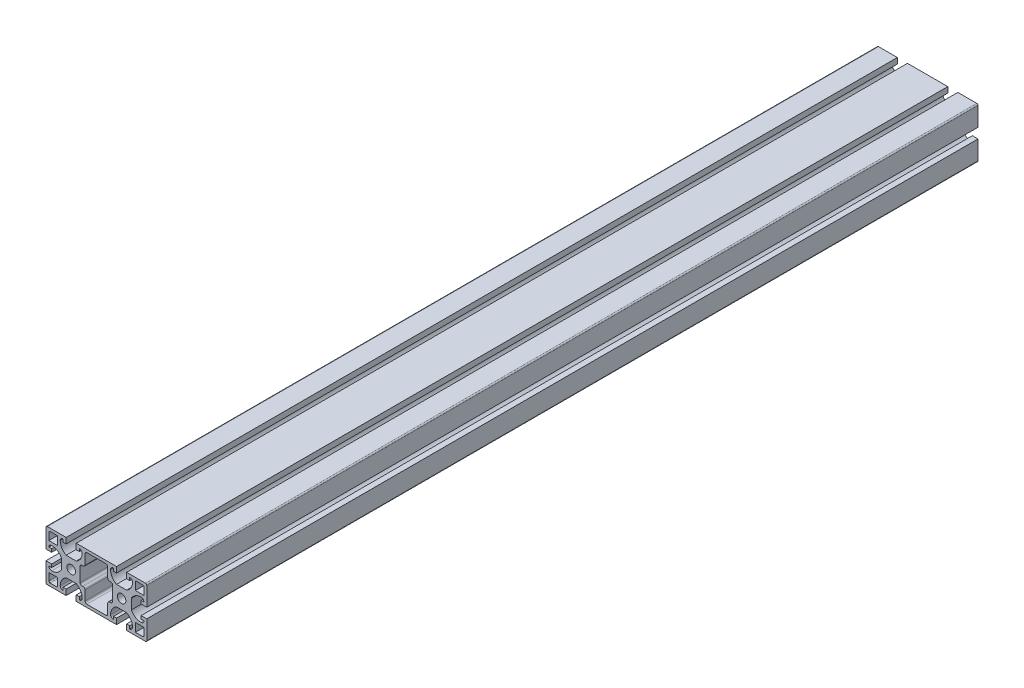
from build123d import *

# Parameters (mm, degrees)
SZKIC1_R                    = 3.4
DODANIE_WYCI_GNI_CIE1_DEPTH = 660
SZKIC2_W                    = 2.25
SZKIC2_H                    = 8
WYTNIJ_WYCI_GNI_CIE1_DEPTH  = 662.513416342


with BuildPart() as part:
    # Szkic1 → Dodanie-wyciągnięcie1 (new body)
    with BuildSketch(Plane.XY):
        with BuildLine():
            Line((-40, -19), (-40, 19))
            ThreePointArc((-40, 19), (-39.707106781, 19.707106781), (-39, 20))
            Line((-39, 20), (-24, 20))
            Line((-24, 20), (-24, 15.5))
            Line((-24, 15.5), (-26.471381771, 15.5))
            Line((-26.471381771, 15.5), (-26.471381771, 17.75))
            ThreePointArc((-26.471381771, 17.75), (-28.062372029, 17.090990258), (-28.721381771, 15.5))
            ThreePointArc((-28.721381771, 15.5), (-27.448087912, 10.962546258), (-24, 7.75))
            Line((-24, 7.75), (-16, 7.75))
            ThreePointArc((-16, 7.75), (-12.551912088, 10.962546258), (-11.278618229, 15.5))
            ThreePointArc((-11.278618229, 15.5), (-11.937627971, 17.090990258), (-13.528618229, 17.75))
            Line((-13.528618229, 17.75), (-13.528618229, 15.5))
            Line((-13.528618229, 15.5), (-16, 15.5))
            Line((-16, 15.5), (-16, 20))
            Line((-16, 20), (13.528618229, 20))
            Line((13.528618229, 20), (16, 20))
            Line((16, 20), (16, 15.5))
            Line((16, 15.5), (13.528618229, 15.5))
            Line((13.528618229, 15.5), (13.528618229, 17.75))
            ThreePointArc((13.528618229, 17.75), (11.937627971, 17.090990258), (11.278618229, 15.5))
            ThreePointArc((11.278618229, 15.5), (12.551912088, 10.962546258), (16, 7.75))
            Line((16, 7.75), (24, 7.75))
            ThreePointArc((24, 7.75), (27.448087912, 10.962546258), (28.721381771, 15.5))
            ThreePointArc((28.721381771, 15.5), (28.062372029, 17.090990258), (26.471381771, 17.75))
            Line((26.471381771, 17.75), (26.471381771, 15.5))
            Line((26.471381771, 15.5), (24, 15.5))
            Line((24, 15.5), (24, 20))
            Line((24, 20), (39, 20))
            ThreePointArc((39, 20), (39.707106781, 19.707106781), (40, 19))
            Line((40, 19), (40, 4))
            Line((40, 4), (35.5, 4))
            Line((35.5, 4), (35.5, 6.471381771))
            Line((35.5, 6.471381771), (37.75, 6.471381771))
            ThreePointArc((37.75, 6.471381771), (37.090990258, 8.062372029), (35.5, 8.721381771))
            ThreePointArc((35.5, 8.721381771), (30.962546258, 7.448087912), (27.75, 4))
            Line((27.75, 4), (27.75, -4))
            ThreePointArc((27.75, -4), (30.962546258, -7.448087912), (35.5, -8.721381771))
            ThreePointArc((35.5, -8.721381771), (37.090990258, -8.062372029), (37.75, -6.471381771))
            Line((37.75, -6.471381771), (35.5, -6.471381771))
            Line((35.5, -6.471381771), (35.5, -4))
            Line((35.5, -4), (40, -4))
            Line((40, -4), (40, -19))
            ThreePointArc((40, -19), (39.707106781, -19.707106781), (39, -20))
            Line((39, -20), (24, -20))
            Line((24, -20), (24, -15.5))
            Line((24, -15.5), (26.471381771, -15.5))
            Line((26.471381771, -15.5), (26.471381771, -17.75))
            ThreePointArc((26.471381771, -17.75), (28.062372029, -17.090990258), (28.721381771, -15.5))
            ThreePointArc((28.721381771, -15.5), (27.448087912, -10.962546258), (24, -7.75))
            Line((24, -7.75), (16, -7.75))
            ThreePointArc((16, -7.75), (12.551912088, -10.962546258), (11.278618229, -15.5))
            ThreePointArc((11.278618229, -15.5), (11.937627971, -17.090990258), (13.528618229, -17.75))
            Line((13.528618229, -17.75), (13.528618229, -15.5))
            Line((13.528618229, -15.5), (16, -15.5))
            Line((16, -15.5), (16, -20))
            Line((16, -20), (-16, -20))
            Line((-16, -20), (-16, -15.5))
            Line((-16, -15.5), (-13.528618229, -15.5))
            Line((-13.528618229, -15.5), (-13.528618229, -17.75))
            ThreePointArc((-13.528618229, -17.75), (-11.937627971, -17.090990258), (-11.278618229, -15.5))
            ThreePointArc((-11.278618229, -15.5), (-12.551912088, -10.962546258), (-16, -7.75))
            Line((-16, -7.75), (-24, -7.75))
            ThreePointArc((-24, -7.75), (-27.448087912, -10.962546258), (-28.721381771, -15.5))
            ThreePointArc((-28.721381771, -15.5), (-28.062372029, -17.090990258), (-26.471381771, -17.75))
            Line((-26.471381771, -17.75), (-26.471381771, -15.5))
            Line((-26.471381771, -15.5), (-24, -15.5))
            Line((-24, -15.5), (-24, -20))
            Line((-24, -20), (-39, -20))
            ThreePointArc((-39, -20), (-39.707106781, -19.707106781), (-40, -19))
        make_face()
        with Locations((-20, 0)):
            Circle(SZKIC1_R, mode=Mode.SUBTRACT)
        with Locations((20, 0)):
            Circle(SZKIC1_R, mode=Mode.SUBTRACT)
        with BuildLine():
            Line((30.971381771, -17.75), (36.75, -17.75))
            ThreePointArc((36.75, -17.75), (37.457106781, -17.457106781), (37.75, -16.75))
            Line((37.75, -16.75), (37.75, -10.971381771))
            Line((37.75, -10.971381771), (30.971381771, -10.971381771))
            Line((30.971381771, -10.971381771), (30.971381771, -17.75))
        make_face(mode=Mode.SUBTRACT)
        with BuildLine():
            Line((-35.5, -6.471381771), (-37.75, -6.471381771))
            ThreePointArc((-37.75, -6.471381771), (-37.090990258, -8.062372029), (-35.5, -8.721381771))
            ThreePointArc((-35.5, -8.721381771), (-30.962546258, -7.448087912), (-27.75, -4))
            Line((-27.75, -4), (-27.75, 4))
            ThreePointArc((-27.75, 4), (-30.962546258, 7.448087912), (-35.5, 8.721381771))
            ThreePointArc((-35.5, 8.721381771), (-37.090990258, 8.062372029), (-37.75, 6.471381771))
            Line((-37.75, 6.471381771), (-35.5, 6.471381771))
            Line((-35.5, 6.471381771), (-35.5, 4))
            Line((-35.5, 4), (-37.75, 4))
            Line((-37.75, 4), (-37.75, -4))
            Line((-37.75, -4), (-35.5, -4))
            Line((-35.5, -4), (-35.5, -6.471381771))
        make_face(mode=Mode.SUBTRACT)
        with BuildLine():
            Line((10.528618229, 7.090188806), (11.40950808, 7.090188806))
            ThreePointArc((11.40950808, 7.090188806), (12.470168251, 6.650848977), (12.90950808, 5.590188806))
            Line((12.90950808, 5.590188806), (12.90950808, -5.590188806))
            ThreePointArc((12.90950808, -5.590188806), (12.470168251, -6.650848977), (11.40950808, -7.090188806))
            Line((11.40950808, -7.090188806), (10.528618229, -7.090188806))
            ThreePointArc((10.528618229, -7.090188806), (9.467958057, -7.529528634), (9.028618229, -8.590188806))
            Line((9.028618229, -8.590188806), (9.028618229, -16.25))
            ThreePointArc((9.028618229, -16.25), (8.589278401, -17.310660172), (7.528618229, -17.75))
            Line((7.528618229, -17.75), (-7.528618229, -17.75))
            ThreePointArc((-7.528618229, -17.75), (-8.589278401, -17.310660172), (-9.028618229, -16.25))
            Line((-9.028618229, -16.25), (-9.028618229, -8.590188806))
            ThreePointArc((-9.028618229, -8.590188806), (-9.467958057, -7.529528634), (-10.528618229, -7.090188806))
            Line((-10.528618229, -7.090188806), (-11.40950808, -7.090188806))
            ThreePointArc((-11.40950808, -7.090188806), (-12.470168251, -6.650848977), (-12.90950808, -5.590188806))
            Line((-12.90950808, -5.590188806), (-12.90950808, 5.590188806))
            ThreePointArc((-12.90950808, 5.590188806), (-12.470168251, 6.650848977), (-11.40950808, 7.090188806))
            Line((-11.40950808, 7.090188806), (-10.528618229, 7.090188806))
            ThreePointArc((-10.528618229, 7.090188806), (-9.467958057, 7.529528634), (-9.028618229, 8.590188806))
            Line((-9.028618229, 8.590188806), (-9.028618229, 16.25))
            ThreePointArc((-9.028618229, 16.25), (-8.589278401, 17.310660172), (-7.528618229, 17.75))
            Line((-7.528618229, 17.75), (7.528618229, 17.75))
            ThreePointArc((7.528618229, 17.75), (8.589278401, 17.310660172), (9.028618229, 16.25))
            Line((9.028618229, 16.25), (9.028618229, 8.590188806))
            ThreePointArc((9.028618229, 8.590188806), (9.467958057, 7.529528634), (10.528618229, 7.090188806))
        make_face(mode=Mode.SUBTRACT)
        with BuildLine():
            Line((30.971381771, 10.971381771), (37.75, 10.971381771))
            Line((37.75, 10.971381771), (37.75, 16.75))
            ThreePointArc((37.75, 16.75), (37.457106781, 17.457106781), (36.75, 17.75))
            Line((36.75, 17.75), (30.971381771, 17.75))
            Line((30.971381771, 17.75), (30.971381771, 10.971381771))
        make_face(mode=Mode.SUBTRACT)
        with BuildLine():
            Line((-30.971381771, -10.971381771), (-30.971381771, -17.75))
            Line((-30.971381771, -17.75), (-36.75, -17.75))
            ThreePointArc((-36.75, -17.75), (-37.457106781, -17.457106781), (-37.75, -16.75))
            Line((-37.75, -16.75), (-37.75, -10.971381771))
            Line((-37.75, -10.971381771), (-30.971381771, -10.971381771))
        make_face(mode=Mode.SUBTRACT)
        with BuildLine():
            Line((-30.971381771, 17.75), (-36.75, 17.75))
            ThreePointArc((-36.75, 17.75), (-37.457106781, 17.457106781), (-37.75, 16.75))
            Line((-37.75, 16.75), (-37.75, 10.971381771))
            Line((-37.75, 10.971381771), (-30.971381771, 10.971381771))
            Line((-30.971381771, 10.971381771), (-30.971381771, 17.75))
        make_face(mode=Mode.SUBTRACT)
    extrude(amount=DODANIE_WYCI_GNI_CIE1_DEPTH)

    # Szkic2 → Wytnij-wyciągnięcie1 (cut, through all)
    with BuildSketch(Plane.XY.offset(660)):
        with Locations((-38.875, 0)):
            Rectangle(SZKIC2_W, SZKIC2_H)
    extrude(amount=-WYTNIJ_WYCI_GNI_CIE1_DEPTH, mode=Mode.SUBTRACT)


solid = part.part
